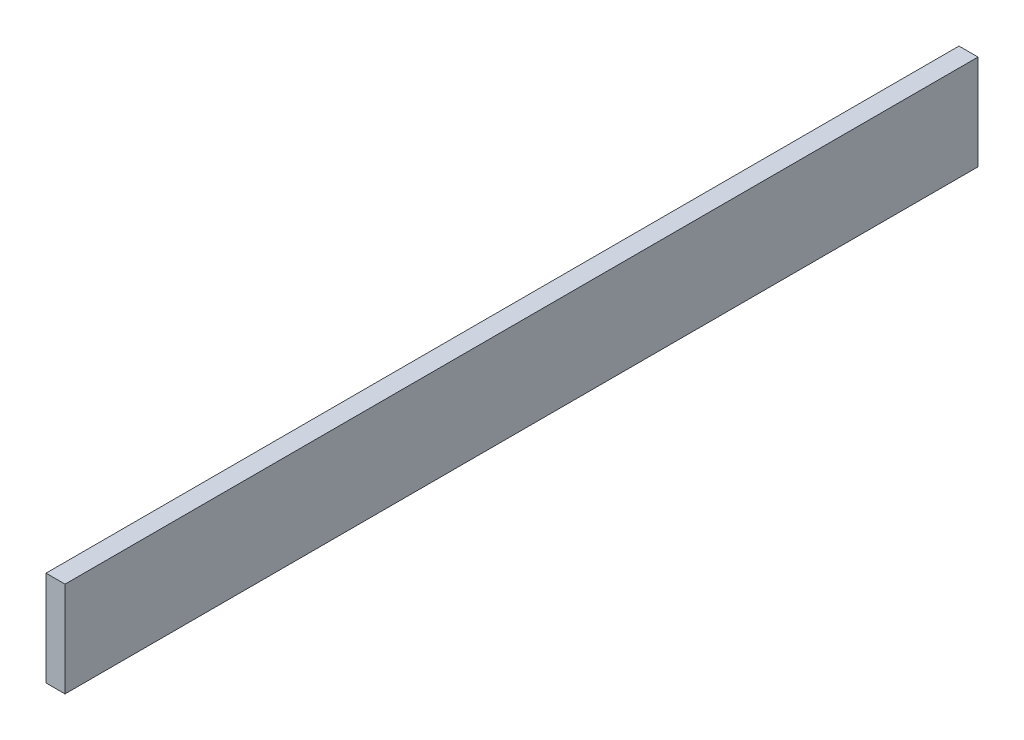
from build123d import *

# Parameters (mm, degrees)
SKETCH1_W           = 20
SKETCH1_H           = 100
BOSS_EXTRUDE1_DEPTH = 960


with BuildPart() as part:
    # Sketch1 → Boss-Extrude1 (new body)
    with BuildSketch(Plane.XY):
        Rectangle(SKETCH1_W, SKETCH1_H)
    extrude(amount=BOSS_EXTRUDE1_DEPTH)


solid = part.part
